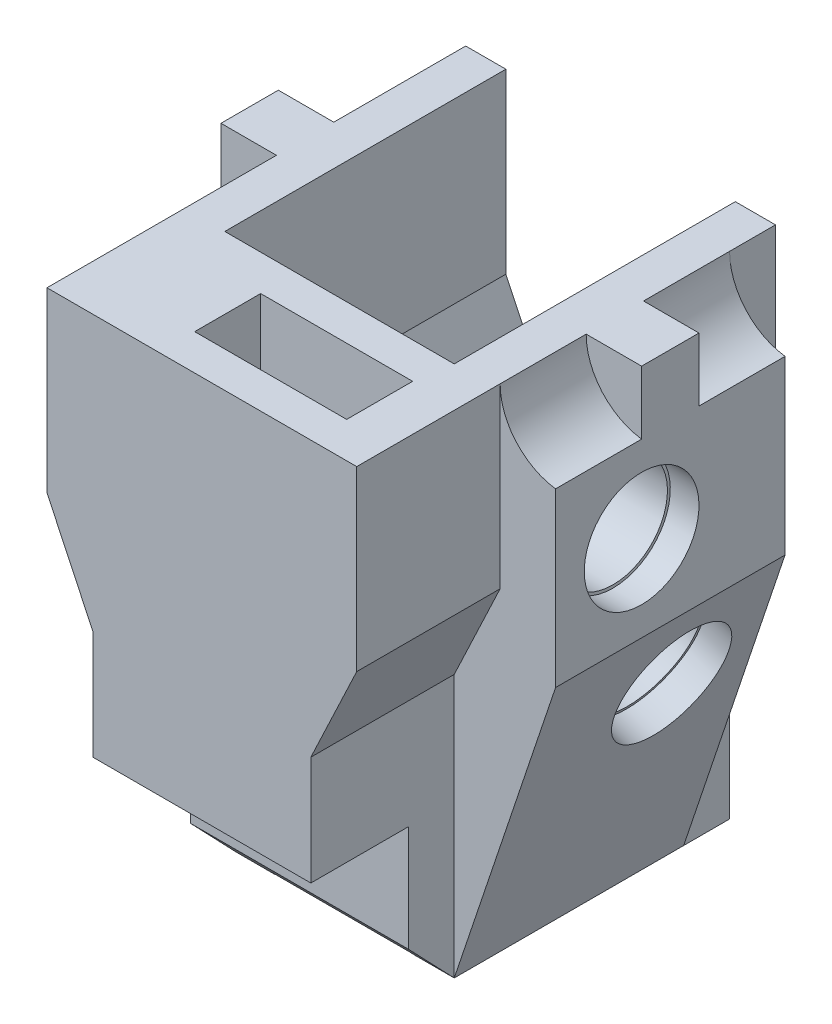
from build123d import *

# Parameters (mm, degrees)
BOSS_EXTRUDE1_DEPTH             = 5.6
BOSS_EXTRUDE2_DEPTH             = 2
BOSS_EXTRUDE2_DEPTH_BACK        = 2
SKETCH4_R                       = 0.95
CUT_EXTRUDE1_DEPTH              = 1.5
SKETCH4_4_R                     = 1
CUT_EXTRUDE2_DEPTH              = 0.5
SKETCH5_R                       = 0.95
CUT_EXTRUDE3_DEPTH              = 1.5
SKETCH5_3_R                     = 1
CUT_EXTRUDE4_DEPTH              = 0.5
BOSS_EXTRUDE3_REACH             = 22.624
SKETCH6_W                       = 0.966611368
SKETCH6_H                       = 1
BOSS_EXTRUDE4_START             = -1.2
SKETCH8_W                       = 0.7
SKETCH8_H                       = 4.583786921
BOSS_EXTRUDE4_DEPTH             = 2.4
BOSS_EXTRUDE5_REACH             = 22.624
SKETCH10_W                      = 0.7
SKETCH10_H                      = 14.923504875
BOSS_EXTRUDE5_DIRECTION_2_REACH = 22.624
SKETCH13_W                      = 7.333222736
SKETCH13_H                      = 6.9
CUT_EXTRUDE8_DEPTH              = 21.62373565
BOSS_EXTRUDE6_REACH             = 16.274
BOSS_EXTRUDE6_DIRECTION_2_REACH = 16.274
CUT_EXTRUDE9_START              = -4.626097
SKETCH14_W                      = 2.44
SKETCH14_H                      = 4.8
CUT_EXTRUDE9_DEPTH              = 4.626097
BOSS_EXTRUDE7_DEPTH             = 1.7
CUT_EXTRUDE10_DEPTH             = 16.595543228
SKETCH18_W                      = 2.44
SKETCH18_H                      = 0.1
CUT_EXTRUDE11_DEPTH             = 16.022577853
CUT_EXTRUDE12_DEPTH             = 16.022577853
CUT_EXTRUDE12_DEPTH_BACK        = 16.022577853
SKETCH20_W                      = 7.333222736
SKETCH20_H                      = 3.236091791
CUT_EXTRUDE13_DEPTH             = 2.5
SKETCH21_3_R                    = 0.95
CUT_EXTRUDE14_DEPTH             = 1.5
SKETCH21_4_R                    = 1.000336047
CUT_EXTRUDE15_DEPTH             = 0.5
SKETCH22_W                      = 2.65
SKETCH22_H                      = 1.15
CUT_EXTRUDE16_DEPTH             = 3.6
SKETCH28_W                      = 3.8
SKETCH28_H                      = 1.7
BOSS_EXTRUDE10_DEPTH            = 0.15


with BuildPart() as part:
    # Sketch1 → Boss-Extrude1 (new body)
    with BuildSketch(Plane.XY):
        Polygon((-1.2, 0), (-1.9, 0), (-1.9, 4.583786921), (-2.7, 6.276200005), (-2.7, 19.507291796), (-2, 19.507291796), (-2, 6.276200005), (-1.2, 4.583786921), align=None)
    extrude(amount=BOSS_EXTRUDE1_DEPTH)

    # Sketch3 → Boss-Extrude2 (add, two sides: drawn at the far end of the back side and taken through both)
    with BuildSketch(Plane.XY.offset(2.8).offset(-BOSS_EXTRUDE2_DEPTH_BACK)):
        with BuildLine():
            Line((-1.9, 0), (-3.666611368, 5.268840762))
            Line((-3.666611368, 5.268840762), (-3.666611368, 8.268840762))
            ThreePointArc((-3.666611368, 8.268840762), (-2.975877619, 8.638135643), (-2.7, 9.371200005))
            Line((-2.7, 9.371200005), (-2.7, 6.276200005))
            Line((-2.7, 6.276200005), (-1.9, 4.583786921))
            Line((-1.9, 4.583786921), (-1.9, 0))
        make_face()
    extrude(amount=BOSS_EXTRUDE2_DEPTH + BOSS_EXTRUDE2_DEPTH_BACK)

    # Sketch4 → Cut-Extrude1 (cut)
    with BuildSketch(Plane.ZY.offset(3.666611368)):
        with Locations(Location((3.3, 6.768840762, 0), (0, 0, 270))):
            Circle(SKETCH4_R)
    extrude(amount=-CUT_EXTRUDE1_DEPTH, mode=Mode.SUBTRACT)

    # Sketch4<4> → Cut-Extrude2 (cut)
    with BuildSketch(Plane.ZY.offset(3.666611368)):
        with Locations(Location((3.3, 6.768840762, 0), (0, 0, 270))):
            Circle(SKETCH4_4_R)
    extrude(amount=-CUT_EXTRUDE2_DEPTH, mode=Mode.SUBTRACT)

    # Sketch5 → Cut-Extrude3 (cut)
    with BuildSketch(Plane(origin=(-1.707984686, -0.572677236, 0), x_dir=(0, 0, 1), z_dir=(-0.9481240996322365, -0.3179004430581389, 0))):
        with Locations(Location((2.3, 4.661132282, 0), (0, 0, 270))):
            Circle(SKETCH5_R)
    extrude(amount=-CUT_EXTRUDE3_DEPTH, mode=Mode.SUBTRACT)

    # Sketch5<3> → Cut-Extrude4 (cut)
    with BuildSketch(Plane(origin=(-1.707984686, -0.572677236, 0), x_dir=(0, 0, 1), z_dir=(-0.9481240996322365, -0.3179004430581389, 0))):
        with Locations(Location((2.3, 4.661132282, 0), (0, 0, 270))):
            Circle(SKETCH5_3_R)
    extrude(amount=-CUT_EXTRUDE4_DEPTH, mode=Mode.SUBTRACT)

    # Sketch6 → Boss-Extrude3 (add, up to next)
    with BuildSketch(Plane(origin=(0, 19.507291796, 0), x_dir=(1, 0, 0), z_dir=(0, 1, 0)), mode=Mode.PRIVATE) as boss_extrude3_sk1:
        with Locations((-3.183305684, -2.8)):
            Rectangle(SKETCH6_W, SKETCH6_H)
    boss_extrude3_tool1 = extrude(boss_extrude3_sk1.sketch, amount=-BOSS_EXTRUDE3_REACH, mode=Mode.PRIVATE) - part.part
    add(boss_extrude3_tool1.solids().sort_by_distance((-3.183306, 19.507292, 2.8))[0])


with BuildPart() as body_2:
    # Mirror7: mirrored copy
    add(part.part.mirror(Plane(origin=(0, 0, 0), x_dir=(0, 0, 1), z_dir=(1, 0, 0))))


with BuildPart() as part_1:
    add(part.part)

    add(body_2.part)  # Boss-Extrude4 merges body 2
    # Sketch8 → Boss-Extrude4 (add)
    with BuildSketch(Plane(origin=(0, 0, 0), x_dir=(0, 0, -1), z_dir=(1, 0, 0)).offset(BOSS_EXTRUDE4_START)):
        with Locations((-5.25, 2.291893461)):
            Rectangle(SKETCH8_W, SKETCH8_H)
    extrude(amount=BOSS_EXTRUDE4_DEPTH)

    # Sketch10 → Boss-Extrude5 (add, up to next)
    with BuildSketch(Plane(origin=(0, 0, 0), x_dir=(0, 0, -1), z_dir=(1, 0, 0)), mode=Mode.PRIVATE) as boss_extrude5_sk1:
        with Locations((-5.25, 12.045539359)):
            Rectangle(SKETCH10_W, SKETCH10_H)
    boss_extrude5_tool1 = extrude(boss_extrude5_sk1.sketch, amount=BOSS_EXTRUDE5_REACH, mode=Mode.PRIVATE) - part_1.part
    add(boss_extrude5_tool1.solids().sort_by_distance((0, 12.045539, 5.25))[0])

    # Sketch10 → Boss-Extrude5 direction 2 (add, up to next)
    with BuildSketch(Plane(origin=(0, 0, 0), x_dir=(0, 0, -1), z_dir=(1, 0, 0)), mode=Mode.PRIVATE) as boss_extrude5_direction_2_sk1:
        with Locations((-5.25, 12.045539359)):
            Rectangle(SKETCH10_W, SKETCH10_H)
    boss_extrude5_direction_2_tool1 = extrude(boss_extrude5_direction_2_sk1.sketch, amount=-BOSS_EXTRUDE5_DIRECTION_2_REACH, mode=Mode.PRIVATE) - part_1.part
    add(boss_extrude5_direction_2_tool1.solids().sort_by_distance((0, 12.045539, 5.25))[0])

    # Sketch13 → Cut-Extrude8 (cut, through all)
    with BuildSketch(Plane.XY.offset(5.6)):
        with Locations((0, 16.057291796)):
            Rectangle(SKETCH13_W, SKETCH13_H)
    extrude(amount=-CUT_EXTRUDE8_DEPTH, mode=Mode.SUBTRACT)

    # Boss-Extrude6: up to this face of the body (flat: up to its plane)
    boss_extrude6_end = Plane(part_1.part.faces().sort_by_distance((1.9, 2.291893461, 5.2))[0])
    # Sketch9 → Boss-Extrude6 (add, up to the picked face)
    with BuildSketch(Plane(origin=(0, 0, 0), x_dir=(0, 0, -1), z_dir=(1, 0, 0)), mode=Mode.PRIVATE) as boss_extrude6_sk1:
        Polygon((-5.58241188, 1.018611498), (-4.8, 0.201293385), (-4.8, -0.528706615), (-5.58241188, 0.288611498), align=None)
    boss_extrude6_tool1 = split(extrude(boss_extrude6_sk1.sketch, amount=BOSS_EXTRUDE6_REACH, mode=Mode.PRIVATE), bisect_by=boss_extrude6_end, keep=Keep.BOTH, mode=Mode.PRIVATE)
    add(boss_extrude6_tool1.solids().sort_by(Axis((0, 0.244952, 5.191206), (1, 0, 0)))[0])

    # Boss-Extrude6 direction 2: up to this face of the body (flat: up to its plane)
    boss_extrude6_direction_2_end = Plane(part_1.part.faces().sort_by_distance((-1.9, 2.291893461, 5.2))[0])
    # Sketch9 → Boss-Extrude6 direction 2 (add, up to the picked face)
    with BuildSketch(Plane(origin=(0, 0, 0), x_dir=(0, 0, -1), z_dir=(1, 0, 0)), mode=Mode.PRIVATE) as boss_extrude6_direction_2_sk1:
        Polygon((-5.58241188, 1.018611498), (-4.8, 0.201293385), (-4.8, -0.528706615), (-5.58241188, 0.288611498), align=None)
    boss_extrude6_direction_2_tool1 = split(extrude(boss_extrude6_direction_2_sk1.sketch, amount=-BOSS_EXTRUDE6_DIRECTION_2_REACH, mode=Mode.PRIVATE), bisect_by=boss_extrude6_direction_2_end, keep=Keep.BOTH, mode=Mode.PRIVATE)
    add(boss_extrude6_direction_2_tool1.solids().sort_by(Axis((0, 0.244952, 5.191206), (-1, 0, 0)))[0])

    # Sketch14 → Cut-Extrude9 (cut)
    with BuildSketch(Plane.XZ.offset(CUT_EXTRUDE9_START)):
        with Locations((0, 2.4)):
            Rectangle(SKETCH14_W, SKETCH14_H)
    extrude(amount=CUT_EXTRUDE9_DEPTH, mode=Mode.SUBTRACT)

    # Sketch16 → Boss-Extrude7 (add)
    with BuildSketch(Plane.XY.offset(5.6)):
        Polygon((-2.7, 12.607291796), (2.7, 12.607291796), (2.7, 6.276200005), (1.9, 4.583786921), (1.9, 2.833786921), (-1.9, 2.833786921), (-1.9, 4.583786921), (-2.7, 6.276200005), align=None)
    extrude(amount=BOSS_EXTRUDE7_DEPTH)

    # Sketch17 → Cut-Extrude10 (cut, through all)
    with BuildSketch(Plane.ZY.offset(1.9)):
        Polygon((4.8, -0.528706615), (4.8, 0), (5.6, 0.835690902), (5.6, 0), (5.306126476, 0), align=None)
    extrude(amount=-CUT_EXTRUDE10_DEPTH, mode=Mode.SUBTRACT)

    # Sketch18 → Cut-Extrude11 (cut, through all)
    with BuildSketch(Plane(origin=(0, 12.607291796, 0), x_dir=(1, 0, 0), z_dir=(0, 1, 0))):
        with Locations((0, -4.85)):
            Rectangle(SKETCH18_W, SKETCH18_H)
    extrude(amount=-CUT_EXTRUDE11_DEPTH, mode=Mode.SUBTRACT)

    # Sketch20 → Cut-Extrude12 (cut, two sides: drawn at the far end of the back side and taken through both)
    with BuildSketch(Plane.XY.offset(7.3).offset(-CUT_EXTRUDE12_DEPTH_BACK)):
        with Locations((0, 10.989245901)):
            Rectangle(SKETCH20_W, SKETCH20_H)
    extrude(amount=CUT_EXTRUDE12_DEPTH + CUT_EXTRUDE12_DEPTH_BACK, mode=Mode.SUBTRACT)

    # Sketch21 → Cut-Extrude13 (cut)
    with BuildSketch(Plane.ZY.offset(2.7)):
        with BuildLine():
            ThreePointArc((6.395601498, 8.251554659), (5.622145346, 8.169301503), (5.704398502, 7.395845352))
            Line((5.704398502, 7.395845352), (6.395601498, 8.251554659))
        make_face()
        with BuildLine():
            Line((6.395601498, 8.251554659), (5.704398502, 7.395845352))
            ThreePointArc((5.704398502, 7.395845352), (6.287085614, 7.327423458), (6.6, 7.823700005))
            ThreePointArc((6.6, 7.823700005), (6.546276548, 8.060785619), (6.395601498, 8.251554659))
        make_face()
    extrude(amount=-CUT_EXTRUDE13_DEPTH, mode=Mode.SUBTRACT)

    # Sketch21<3> → Cut-Extrude14 (cut)
    with BuildSketch(Plane.ZY.offset(2.7)):
        with Locations(Location((6.05, 7.823700005, 0), (0, 0, 270))):
            Circle(SKETCH21_3_R)
    extrude(amount=-CUT_EXTRUDE14_DEPTH, mode=Mode.SUBTRACT)

    # Sketch21<4> → Cut-Extrude15 (cut)
    with BuildSketch(Plane.ZY.offset(2.7)):
        with Locations(Location((6.05, 7.823700005, 0), (0, 0, 270))):
            Circle(SKETCH21_4_R)
    extrude(amount=-CUT_EXTRUDE15_DEPTH, mode=Mode.SUBTRACT)

    # Sketch22 → Cut-Extrude16 (cut)
    with BuildSketch(Plane(origin=(0, 9.371200005, 0), x_dir=(1, 0, 0), z_dir=(0, 1, 0))):
        with Locations((0.575, -6.1)):
            Rectangle(SKETCH22_W, SKETCH22_H)
    extrude(amount=-CUT_EXTRUDE16_DEPTH, mode=Mode.SUBTRACT)

    # Sketch28 → Boss-Extrude10 (add)
    with BuildSketch(Plane.XZ.offset(-2.833786921)):
        with Locations((0, 6.45)):
            Rectangle(SKETCH28_W, SKETCH28_H)
    extrude(amount=BOSS_EXTRUDE10_DEPTH)


solid = part_1.part
